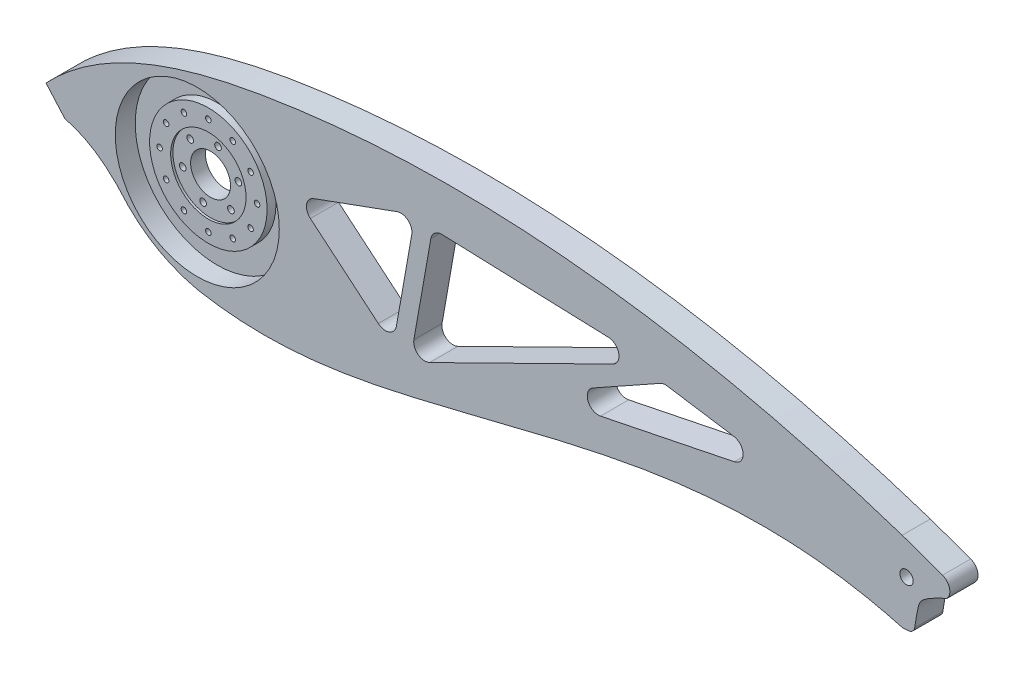
from build123d import *

# Parameters (mm, degrees)
SALIENTE_EXTRUIR1_DEPTH = 12.7
CORTAR_EXTRUIR20_DEPTH  = 62
CROQUIS12_R             = 26
CROQUIS12_R_2           = 17
CORTAR_EXTRUIR21_DEPTH  = 4
CROQUIS6_R              = 1.25
CORTAR_EXTRUIR22_DEPTH  = 29
CROQUIS13_R             = 1.5
CORTAR_EXTRUIR23_DEPTH  = 29
CROQUIS8_R              = 3
CORTAR_EXTRUIR27_DEPTH  = 64
CROQUIS5_R              = 36
CORTAR_EXTRUIR28_DEPTH  = 4
CROQUIS22_R             = 27
CORTAR_EXTRUIR32_DEPTH  = 1
CORTAR_EXTRUIR33_START  = -1
CROQUIS23_R             = 17
CORTAR_EXTRUIR33_DEPTH  = 1
CROQUIS24_R             = 9
CORTAR_EXTRUIR34_DEPTH  = 67
CROQUIS26_R             = 37
CROQUIS26_R_2           = 26.5
CORTAR_EXTRUIR38_DEPTH  = 9


with BuildPart() as part:
    # Croquis2 → Saliente-Extruir1 (new body)
    with BuildSketch(Plane.XY):
        with BuildLine():
            add(Edge.make_bspline(
                [(318.003849686, 21.000507192), (228.612845689, 50.579171404), (93.837740705, 69.713331037), (-40.897656903, 33.469788637), (-68.237071347, 4.559111896)],
                knots=[0, 0, 0, 0, 0.7074371, 1, 1, 1, 1], degree=3))
            Line((-68.237071347, 4.559111896), (-59.653213383, -5.20395025))
            add(Edge.make_bspline(
                [(-31, -25), (-39.39631193, -15.138516418), (-48.385558495, -7.834552383), (-59.653213383, -5.20395025)],
                knots=[0.5325633, 0.5325633, 0.5325633, 0.5325633, 1, 1, 1, 1], degree=3))
            add(Edge.make_bspline(
                [(0, -42), (-18.317933693, -37.788499598), (-31, -25)],
                knots=[0, 0, 0, 0.892929879, 0.892929879, 0.892929879], degree=2))
            add(Edge.make_bspline(
                [(0, -42), (34.804106533, -48.583870116), (140.601557422, -28.662967351), (242.066250638, 5.979270436), (318.003849686, -15.054295763)],
                knots=[0, 0, 0, 0, 0.322299538, 1, 1, 1, 1], degree=3))
            ThreePointArc((318.003849686, -15.054295763), (319.540823222, -15.003980459), (321.071215203, -14.853250005))
            ThreePointArc((321.071215203, -14.853250005), (322.775428516, -14.025460634), (323.64375194, -12.341538815))
            add(Edge.make_bspline(
                [(338, 6.2), (337.96483394, 6.165565228), (334.391730923, 4.926696382), (325.456575586, -0.138969503), (325.231234185, -2.170240746), (323.64375194, -12.341538815)],
                knots=[0.205943753, 0.205943753, 0.205943753, 0.205943753, 0.210383616, 0.534400108, 0.959977028, 0.959977028, 0.959977028, 0.959977028], degree=3))
            ThreePointArc((338, 6.2), (339.38638351, 10.840617369), (336.189590247, 14.479010095))
            Line((336.189590247, 14.479010095), (318.003849686, 21.000507192))
        make_face()
    extrude(amount=SALIENTE_EXTRUIR1_DEPTH)

    # Croquis15 → Cortar-Extruir20 (cut)
    with BuildSketch(Plane.XY.offset(12.7)):
        with BuildLine():
            Line((97.723501447, -12.756776492), (105.361190757, 30.558712033))
            ThreePointArc((105.361190757, 30.558712033), (107.138627567, 33.576200952), (110.459727005, 34.68742528))
            Line((110.459727005, 34.68742528), (185.414039032, 32.069963027))
            ThreePointArc((185.414039032, 32.069963027), (190.128162759, 28.12247669), (187.449594034, 22.587959504))
            Line((187.449594034, 22.587959504), (104.857592698, -18.110066768))
            ThreePointArc((104.857592698, -18.110066768), (99.646563775, -17.624284866), (97.723501447, -12.756776492))
        make_face()
        with BuildLine():
            Line((89.822655638, -11.494535825), (96.768582744, 27.897774295))
            ThreePointArc((96.768582744, 27.897774295), (95.058482028, 32.596237399), (90.134443263, 33.464478287))
            Line((90.134443263, 33.464478287), (52.546738431, 19.783672554))
            ThreePointArc((52.546738431, 19.783672554), (49.332800383, 15.953450339), (51.0429011, 11.254987235))
            Line((51.0429011, 11.254987235), (81.684678824, -14.456517153))
            ThreePointArc((81.684678824, -14.456517153), (86.608717589, -15.324758041), (89.822655638, -11.494535825))
        make_face()
        with BuildLine():
            Line((178.485600868, 8.76169092), (208.786453861, 25.718640542))
            ThreePointArc((208.786453861, 25.718640542), (210.340015249, 26.275882173), (211.990356529, 26.296974372))
            Line((211.990356529, 26.296974372), (242.009853595, 21.667000055))
            ThreePointArc((242.009853595, 21.667000055), (246.246230456, 16.846807749), (242.248805987, 11.826674245))
            Line((242.248805987, 11.826674245), (181.928455927, -0.50030106))
            ThreePointArc((181.928455927, -0.50030106), (176.240671419, 2.65632611), (178.485600868, 8.76169092))
        make_face()
    extrude(amount=-CORTAR_EXTRUIR20_DEPTH, mode=Mode.SUBTRACT)

    # Croquis12 → Cortar-Extruir21 (cut)
    with BuildSketch(Plane(origin=(0, 0, 0), x_dir=(-1, 0, 0), z_dir=(0, 0, -1))):
        Circle(CROQUIS12_R)
        Circle(CROQUIS12_R_2, mode=Mode.SUBTRACT)
    extrude(amount=-CORTAR_EXTRUIR21_DEPTH, mode=Mode.SUBTRACT)

    # Croquis6 → Cortar-Extruir22 (cut)
    with BuildSketch(Plane.XY.offset(12.7)):
        with Locations((0, 22)):
            Circle(CROQUIS6_R)
        with Locations((11, 19.052558883)):
            Circle(CROQUIS6_R)
        with Locations((19.052558883, 11)):
            Circle(CROQUIS6_R)
        with Locations((22, 0)):
            Circle(CROQUIS6_R)
        with Locations((19.052558883, -11)):
            Circle(CROQUIS6_R)
        with Locations((11, -19.052558883)):
            Circle(CROQUIS6_R)
        with Locations((0, -22)):
            Circle(CROQUIS6_R)
        with Locations((-11, -19.052558883)):
            Circle(CROQUIS6_R)
        with Locations((-19.052558883, -11)):
            Circle(CROQUIS6_R)
        with Locations((-22, 0)):
            Circle(CROQUIS6_R)
        with Locations((-19.052558883, 11)):
            Circle(CROQUIS6_R)
        with Locations((-11, 19.052558883)):
            Circle(CROQUIS6_R)
    extrude(amount=-CORTAR_EXTRUIR22_DEPTH, mode=Mode.SUBTRACT)

    # Croquis13 → Cortar-Extruir23 (cut)
    with BuildSketch(Plane(origin=(0, 0, 0), x_dir=(-1, 0, 0), z_dir=(0, 0, -1))):
        with Locations((12.557035742, -3.364647586)):
            Circle(CROQUIS13_R)
        with Locations((3.364647586, -12.557035742)):
            Circle(CROQUIS13_R)
        with Locations((-9.192388155, -9.192388155)):
            Circle(CROQUIS13_R)
        with Locations((9.192388155, 9.192388155)):
            Circle(CROQUIS13_R)
        with Locations((-12.557035742, 3.364647586)):
            Circle(CROQUIS13_R)
        with Locations((-3.364647586, 12.557035742)):
            Circle(CROQUIS13_R)
    extrude(amount=-CORTAR_EXTRUIR23_DEPTH, mode=Mode.SUBTRACT)

    # Croquis8 → Cortar-Extruir27 (cut)
    with BuildSketch(Plane.XY.offset(12.7)):
        with Locations((319.95126245, 5.58477006)):
            Circle(CROQUIS8_R)
    extrude(amount=-CORTAR_EXTRUIR27_DEPTH, mode=Mode.SUBTRACT)

    # Croquis5 → Cortar-Extruir28 (cut)
    with BuildSketch(Plane.XY.offset(12.7)):
        Circle(CROQUIS5_R)
    extrude(amount=-CORTAR_EXTRUIR28_DEPTH, mode=Mode.SUBTRACT)

    # Croquis22 → Cortar-Extruir32 (cut)
    with BuildSketch(Plane.XY.offset(8.7)):
        Circle(CROQUIS22_R)
    extrude(amount=-CORTAR_EXTRUIR32_DEPTH, mode=Mode.SUBTRACT)

    # Croquis23 → Cortar-Extruir33 (cut)
    with BuildSketch(Plane.XY.offset(7.7).offset(CORTAR_EXTRUIR33_START)):
        with Locations(Location((0, 0, 0), (0, 0, 180))):
            Circle(CROQUIS23_R)
    extrude(amount=CORTAR_EXTRUIR33_DEPTH, mode=Mode.SUBTRACT)

    # Croquis24 → Cortar-Extruir34 (cut)
    with BuildSketch(Plane(origin=(0, 0, 0), x_dir=(-1, 0, 0), z_dir=(0, 0, -1))):
        Circle(CROQUIS24_R)
    extrude(amount=-CORTAR_EXTRUIR34_DEPTH, mode=Mode.SUBTRACT)

    # Croquis26 → Cortar-Extruir38 (cut)
    with BuildSketch(Plane.XY.offset(12.7)):
        Circle(CROQUIS26_R)
        Circle(CROQUIS26_R_2, mode=Mode.SUBTRACT)
    extrude(amount=-CORTAR_EXTRUIR38_DEPTH, mode=Mode.SUBTRACT)


solid = part.part
